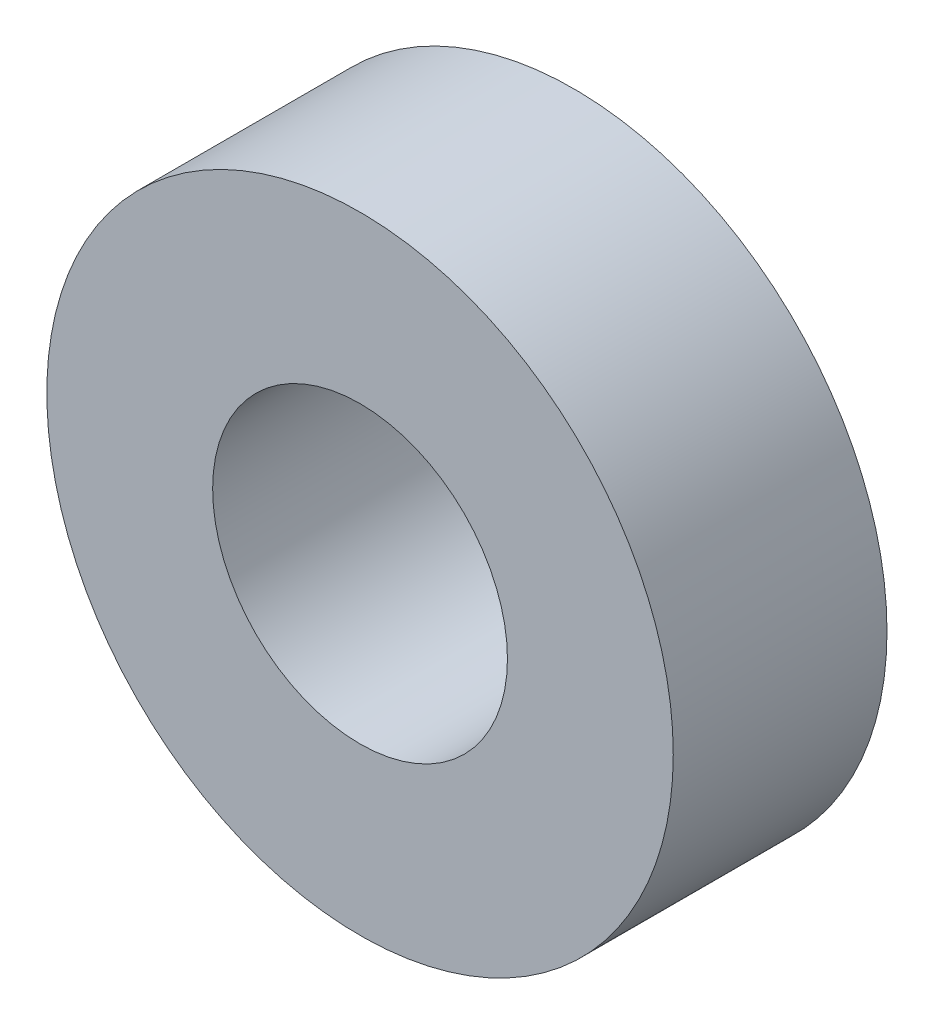
from build123d import *

# Parameters (mm, degrees)
SKETCH1_R           = 8.5
SKETCH1_R_2         = 4
BOSS_EXTRUDE1_DEPTH = 5.8


with BuildPart() as part:
    # Sketch1 → Boss-Extrude1 (new body)
    with BuildSketch(Plane.XY):
        Circle(SKETCH1_R)
        Circle(SKETCH1_R_2, mode=Mode.SUBTRACT)
    extrude(amount=BOSS_EXTRUDE1_DEPTH)


solid = part.part
